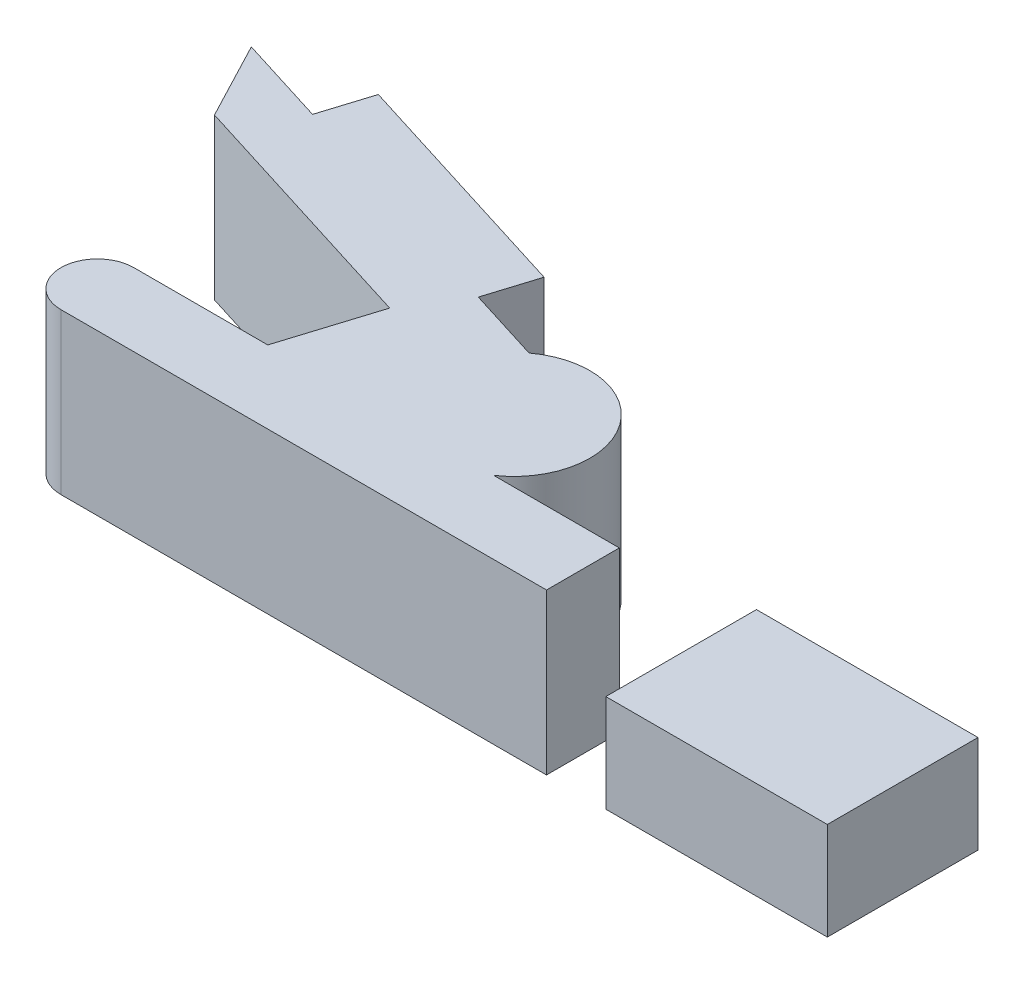
from build123d import *

# Parameters (mm, degrees)
EXTRUDE_1_DEPTH     = 33
SKETCH_1_W          = 45.629751387
SKETCH_1_H          = 31.029699077
EXTRUDE_1_2_DEPTH   = 33
SKETCH_4_W          = 45.629751387
SKETCH_4_H          = 12.90510153
CUT_EXTRUDE_1_DEPTH = 33


with BuildPart() as part:
    # 草图1 → 凸台-拉伸1 (new body)
    with BuildSketch(Plane(origin=(0, 0, 0), x_dir=(1, 0, 0), z_dir=(0, 1, 0))):
        with BuildLine():
            Line((-88.633640643, 48.980495872), (-80.284516642, 33.041259142))
            Line((-80.284516642, 33.041259142), (-27.796591183, 16.638782436))
            Line((-27.796591183, 16.638782436), (-33.775142622, -2.492582169))
            Line((-33.775142622, -2.492582169), (-61.362867608, -2.492582169))
            ThreePointArc((-61.362867608, -2.492582169), (-68.862867608, -9.992582169), (-61.362867608, -17.492582169))
            Line((-61.362867608, -17.492582169), (38.637132392, -17.492582169))
            Line((38.637132392, -17.492582169), (38.637132392, -2.492582169))
            Line((38.637132392, -2.492582169), (12.743824311, -2.492582169))
            ThreePointArc((12.743824311, -2.492582169), (16.704464531, 19.547282527), (-5.424152751, 22.977530906))
            Line((-5.424152751, 22.977530906), (-20.630552368, 27.729530786))
            Line((-20.630552368, 27.729530786), (-17.406105012, 38.047762325))
            Line((-17.406105012, 38.047762325), (-67.063269568, 53.565626248))
            Line((-67.063269568, 53.565626248), (-70.287716924, 43.24739471))
            Line((-70.287716924, 43.24739471), (-88.633640643, 48.980495872))
        make_face()
    extrude(amount=EXTRUDE_1_DEPTH)


with BuildPart() as body_2:
    # 草图1 → Extrude 1 2 (new body)
    with BuildSketch(Plane(origin=(0, 0, 0), x_dir=(1, 0, 0), z_dir=(0, 1, 0))):
        with Locations((73.664502877, -1.977732631)):
            Rectangle(SKETCH_1_W, SKETCH_1_H)
    extrude(amount=EXTRUDE_1_2_DEPTH)

    # 草图4 → 切除-拉伸1 (cut)
    with BuildSketch(Plane.XY.offset(17.492582169)):
        with Locations((73.664502877, 26.547449235)):
            Rectangle(SKETCH_4_W, SKETCH_4_H)
    extrude(amount=-CUT_EXTRUDE_1_DEPTH, mode=Mode.SUBTRACT)


solid = Compound([part.part, body_2.part])
